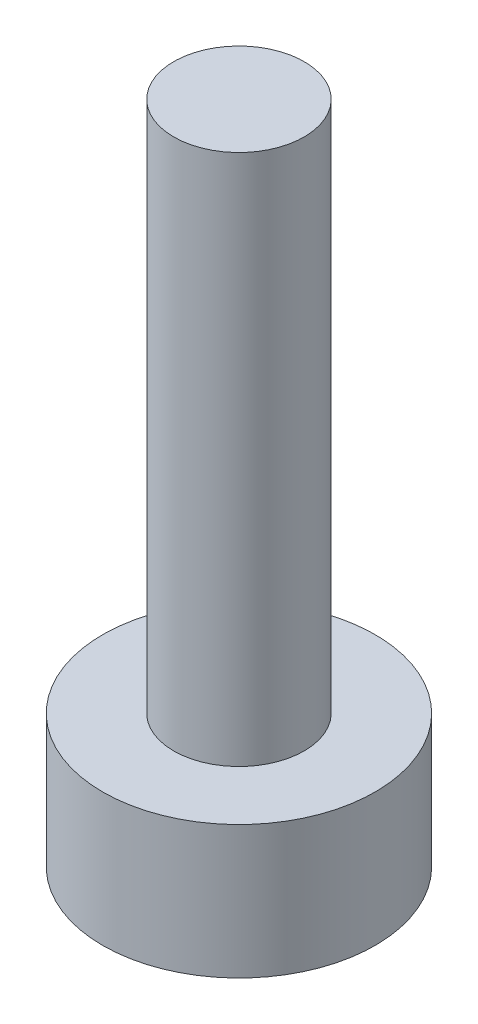
from build123d import *

# Parameters (mm, degrees)
SKETCH1_R           = 5.125
BOSS_EXTRUDE1_DEPTH = 5
SKETCH2_R           = 2.453953654
BOSS_EXTRUDE2_DEPTH = 20
CUT_EXTRUDE1_DEPTH  = 1.5


with BuildPart() as part:
    # Sketch1 → Boss-Extrude1 (new body)
    with BuildSketch(Plane(origin=(0, 0, 0), x_dir=(1, 0, 0), z_dir=(0, 1, 0))):
        with Locations(Location((0, 0, 0), (0, 0, 270))):
            Circle(SKETCH1_R)
    extrude(amount=BOSS_EXTRUDE1_DEPTH)

    # Sketch2 → Boss-Extrude2 (add)
    with BuildSketch(Plane(origin=(0, 5, 0), x_dir=(1, 0, 0), z_dir=(0, 1, 0))):
        with Locations(Location((0, 0, 0), (0, 0, 270))):
            Circle(SKETCH2_R)
    extrude(amount=BOSS_EXTRUDE2_DEPTH)

    # Sketch3 → Cut-Extrude1 (cut)
    with BuildSketch(Plane.XZ):
        Polygon((-2.457663411, 3.458774555), (2.457663411, 3.458774555), (4.098970094, 0), (2.457663411, -3.458774555), (-2.457663411, -3.458774555), (-4.098970094, 0), align=None)
    extrude(amount=-CUT_EXTRUDE1_DEPTH, mode=Mode.SUBTRACT)


solid = part.part
